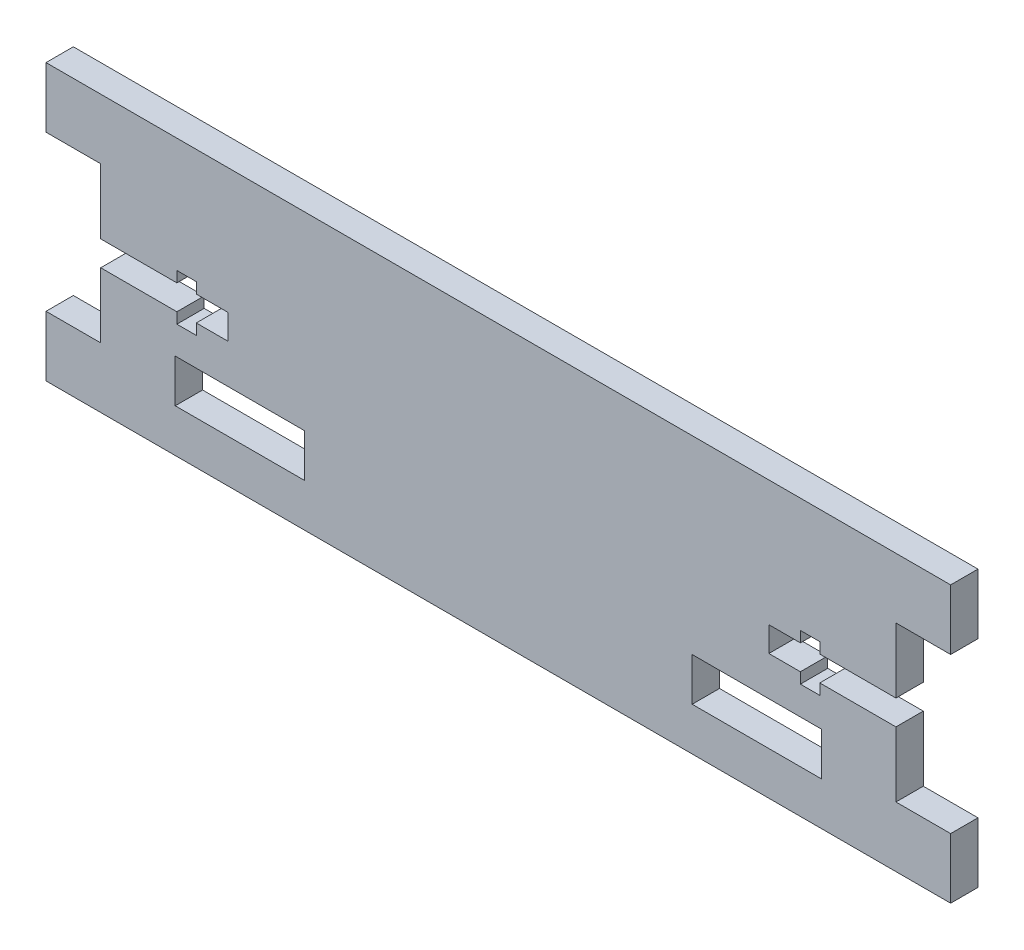
from build123d import *

# Parameters (mm, degrees)
SKETCH1_W      = 15
SKETCH1_H      = 5
EXTRUDE1_DEPTH = 3.175


with BuildPart() as part:
    # Sketch1 → Extrude1 (new body)
    with BuildSketch(Plane.XY):
        Polygon((92.127144536, 5.990828295), (92.127144536, 12.990828295), (85.777144536, 12.990828295), (85.777144536, 20.540828295), (76.937144536, 20.540828295), (76.937144536, 19.290828295), (74.687144536, 19.290828295), (74.687144536, 20.540828295), (71.027144536, 20.540828295), (71.027144536, 23.440828295), (74.687144536, 23.440828295), (74.687144536, 24.690828295), (76.937144536, 24.690828295), (76.937144536, 23.440828295), (85.777144536, 23.440828295), (85.777144536, 30.990828295), (92.127144536, 30.990828295), (92.127144536, 37.990828295), (-12.872855464, 37.990828295), (-12.872855464, 30.990828295), (-6.522855464, 30.990828295), (-6.522855464, 23.440828295), (2.317144536, 23.440828295), (2.317144536, 24.690828295), (4.567144536, 24.690828295), (4.567144536, 23.440828295), (8.227144536, 23.440828295), (8.227144536, 20.540828295), (4.567144536, 20.540828295), (4.567144536, 19.290828295), (2.317144536, 19.290828295), (2.317144536, 20.540828295), (-6.522855464, 20.540828295), (-6.522855464, 12.990828295), (-12.872855464, 12.990828295), (-12.872855464, 5.990828295), align=None)
        with Locations((9.627144536, 13.490828295)):
            Rectangle(SKETCH1_W, SKETCH1_H, mode=Mode.SUBTRACT)
        with Locations((69.627144536, 13.490828295)):
            Rectangle(SKETCH1_W, SKETCH1_H, mode=Mode.SUBTRACT)
    extrude(amount=EXTRUDE1_DEPTH)


solid = part.part
